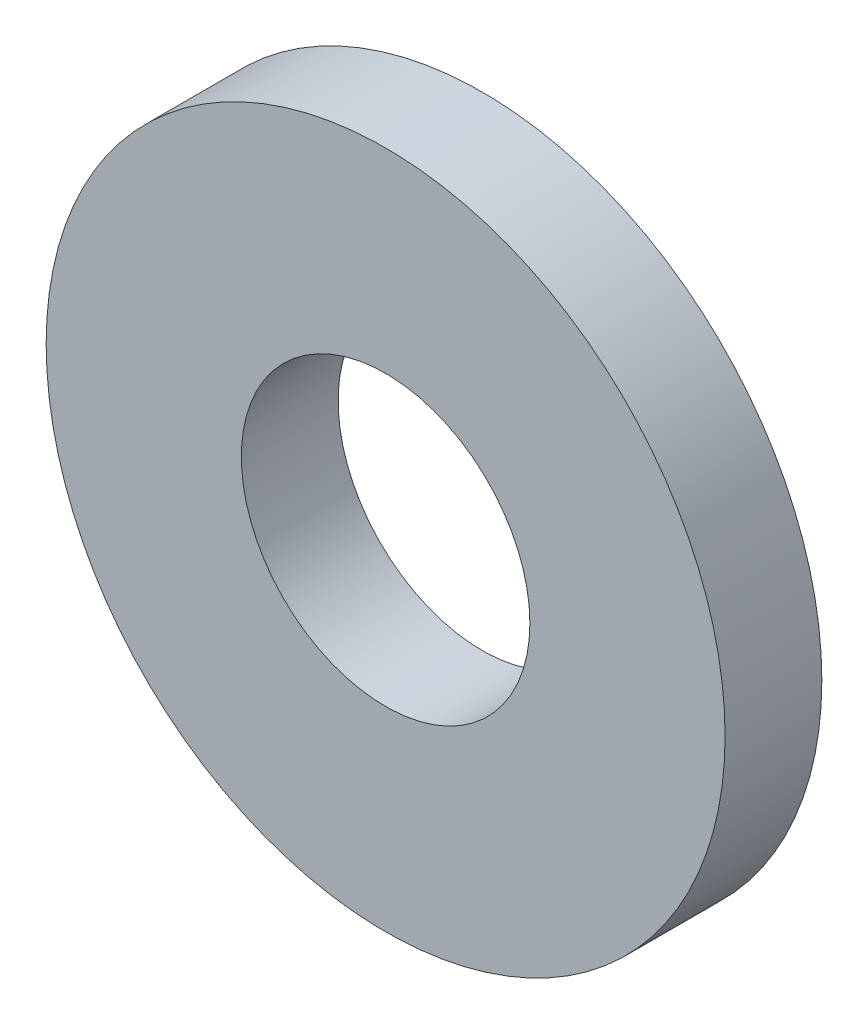
from build123d import *

# Parameters (mm, degrees)
SKETCH3_R           = 20
SKETCH3_R_2         = 8.5
BOSS_EXTRUDE1_DEPTH = 2.85


with BuildPart() as part:
    # Sketch3 → Boss-Extrude1 (new, symmetric)
    with BuildSketch(Plane.XY):
        Circle(SKETCH3_R)
        Circle(SKETCH3_R_2, mode=Mode.SUBTRACT)
    extrude(amount=BOSS_EXTRUDE1_DEPTH, both=True)


solid = part.part
